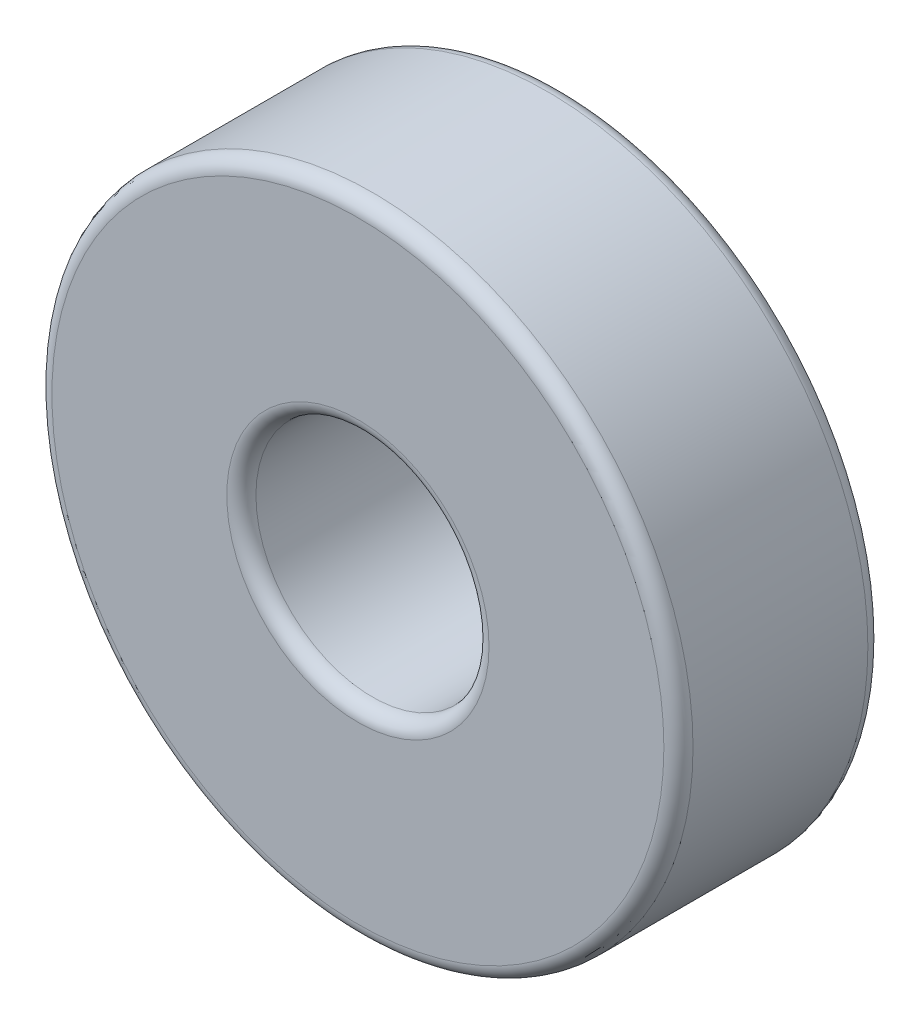
from build123d import *

# Parameters (mm, degrees)
CROQUIS1_R              = 11
CROQUIS1_R_2            = 4
SALIENTE_EXTRUIR1_DEPTH = 7
REDONDEO1_R             = 0.5


with BuildPart() as part:
    # Croquis1 → Saliente-Extruir1 (new body)
    with BuildSketch(Plane.XY):
        Circle(CROQUIS1_R)
        Circle(CROQUIS1_R_2, mode=Mode.SUBTRACT)
    extrude(amount=SALIENTE_EXTRUIR1_DEPTH)

    # Redondeo1
    redondeo1_edges = [part.edges().sort_by_distance(p)[0] for p in [
        (-11, 0, 0),
        (-11, 0, 7),
        (-4, 0, 0),
        (-4, 0, 7),
    ]]
    fillet(redondeo1_edges, radius=REDONDEO1_R)


solid = part.part
